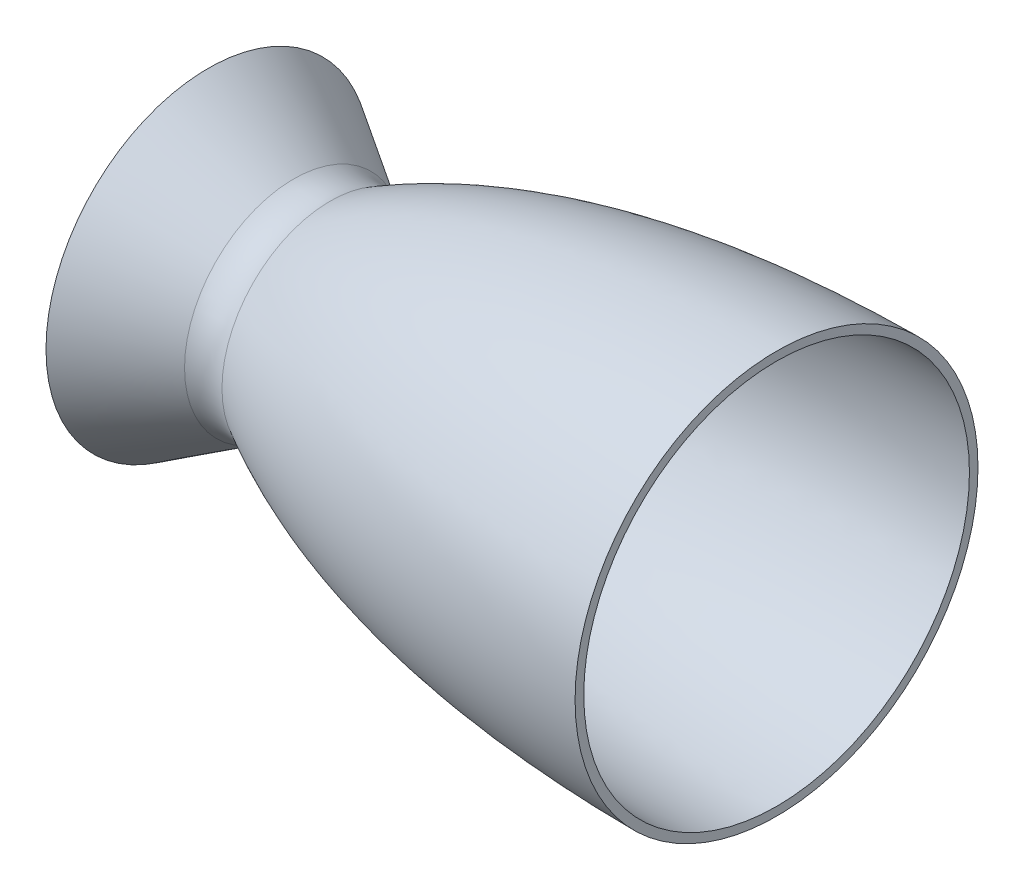
from build123d import *


with BuildPart() as part:
    # Sketch1 → Revolve1 (revolve)
    with BuildSketch(Plane.XY, mode=Mode.PRIVATE) as revolve1_sk:
        with BuildLine():
            Line((-14.113245912, 37.975775227), (-43.86675095, 56.407512474))
            Line((-43.86675095, 56.407512474), (-45.446614143, 53.857212042))
            Line((-45.446614143, 53.857212042), (-15.693109105, 35.425474795))
            ThreePointArc((-15.693109105, 35.425474795), (-7.895414834, 33.410586627), (0, 35))
            add(Edge.make_bspline(
                [(0, 35), (0.59156018, 35.323485617), (1.603948821, 35.877094827), (3.051327403, 36.650931101), (4.346141775, 37.330720953), (6.586352571, 38.485020212), (8.883217116, 39.623285644), (11.237767823, 40.744923374), (13.214481543, 41.667374939), (15.239349707, 42.582517805), (17.313701417, 43.490027515), (19.477351373, 44.415543862), (22.279340199, 45.572934389), (25.15820829, 46.706065259), (27.544902903, 47.610972798), (30.043623951, 48.534070134), (32.609716723, 49.444254055), (35.245143281, 50.340972423), (37.295510001, 51.018673151), (40.134935415, 51.929605817), (43.829781945, 53.060452335), (47.635228948, 54.151189622), (50.804890347, 55.013925574), (53.279042389, 55.663329131), (56.717180167, 56.532287614), (60.259072341, 57.375212698), (64.8843177, 58.409306157), (69.786190032, 59.432837045), (74.846703817, 60.391032215), (79.081491153, 61.131961784), (82.404312022, 61.681011946), (85.832979398, 62.214214906), (89.37216293, 62.730181094), (93.026774406, 63.22746705), (96.802023676, 63.704442146), (100.703406604, 64.159406934), (104.736743585, 64.590566244), (108.908202819, 64.995917659), (113.224319769, 65.373359277), (117.692028583, 65.720619449), (122.318697892, 66.035232011), (127.112150271, 66.31460432), (132.080718014, 66.555810346), (137.233267302, 66.756084434), (142.5792649, 66.910947337), (148.128776443, 67.021468292), (151.897616649, 67.050255108), (153.81758, 67.06492)],
                knots=[0, 0, 0, 0, 0.012742535, 0.021807413, 0.031018552, 0.040381193, 0.069435712, 0.079462862, 0.089671691, 0.110661788, 0.121457293, 0.132463052, 0.155137217, 0.178751144, 0.190932867, 0.20337726, 0.229094582, 0.242389023, 0.255989109, 0.269906814, 0.298745972, 0.329014119, 0.344720545, 0.360829492, 0.377357568, 0.411741901, 0.429635855, 0.466929188, 0.506378366, 0.526971724, 0.548179084, 0.570028568, 0.592549693, 0.615773907, 0.639734295, 0.664466086, 0.69000659, 0.71639543, 0.743674651, 0.77188904, 0.801086202, 0.831316904, 0.862635144, 0.895098748, 0.928769334, 0.963712904, 1, 1, 1, 1], degree=3))
            Line((153.81758, 67.06492), (153.794666338, 70.064832493))
            add(Edge.make_bspline(
                [(-1.439355313, 37.632158104), (0.029740224, 38.43551048), (2.97385425, 40.02334962), (8.980017901, 43.044504251), (19.657767388, 47.931743277), (35.360461061, 53.820993314), (54.663474572, 59.341203786), (80.798859164, 64.912209277), (107.285483452, 68.18745636), (130.536302376, 69.551561912), (143.833403176, 69.966219235), (150.473331624, 70.039463772), (153.794666338, 70.064832493)],
                knots=[0, 0, 0, 0, 0.03125, 0.0625, 0.125, 0.25, 0.375, 0.5, 0.75, 0.875, 0.9375, 1, 1, 1, 1], degree=3))
            ThreePointArc((-1.439355313, 37.632158104), (-7.814389654, 36.399099715), (-14.113245912, 37.975775227))
        make_face()
    revolve(revolve1_sk.sketch.rotate(Axis((-85.916362679, 0, 0), (1, 0, 0)), 90), axis=Axis((-85.916362679, 0, 0), (1, 0, 0)))


solid = part.part
